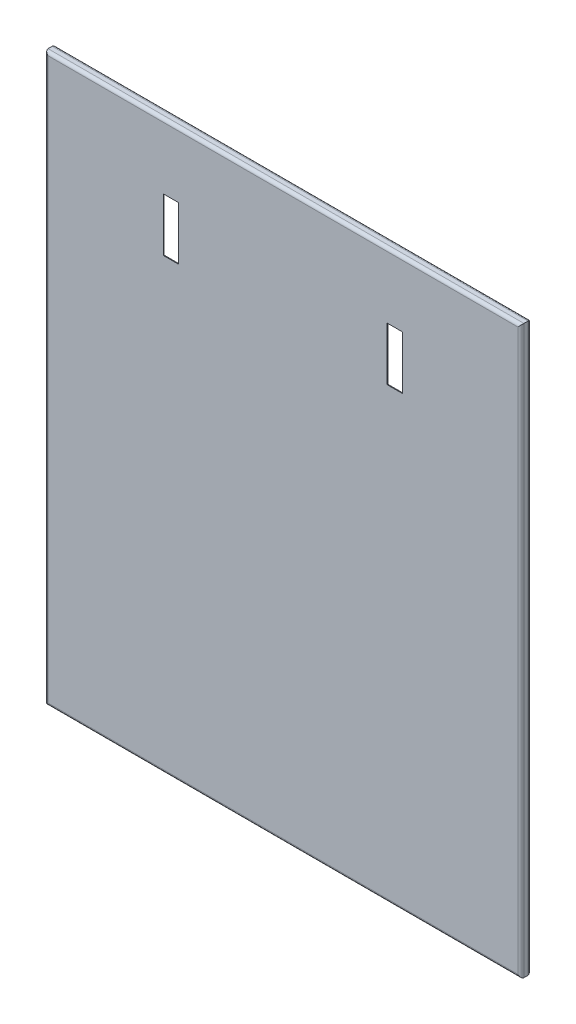
from build123d import *

# Parameters (mm, degrees)
SKETCH_1_W      = 776
SKETCH_1_H      = 924
SKETCH_1_W_2    = 25
SKETCH_1_H_2    = 87
EXTRUDE_1_DEPTH = 1.2
SKETCH_2_W      = 776
SKETCH_2_H      = 924
SKETCH_2_W_2    = 773.6
SKETCH_2_H_2    = 921.6
EXTRUDE_2_DEPTH = 15.5
SKETCH_3_W      = 776
SKETCH_3_H      = 924
SKETCH_3_W_2    = 746
SKETCH_3_H_2    = 894
EXTRUDE_3_DEPTH = 1.2
FILLET_1_R      = 2
FILLET_2_R      = 5
FILLET_3_R      = 5


with BuildPart() as part:
    # 스케치1 → 보스-돌출1 (new body)
    with BuildSketch(Plane.XY):
        with Locations((388, 462)):
            Rectangle(SKETCH_1_W, SKETCH_1_H)
        with Locations((205.5, 774.5)):
            Rectangle(SKETCH_1_W_2, SKETCH_1_H_2, mode=Mode.SUBTRACT)
        with Locations((570.5, 774.5)):
            Rectangle(SKETCH_1_W_2, SKETCH_1_H_2, mode=Mode.SUBTRACT)
    extrude(amount=EXTRUDE_1_DEPTH)

    # 스케치2 → 보스-돌출2 (add)
    with BuildSketch(Plane(origin=(0, 0, 0), x_dir=(-1, 0, 0), z_dir=(0, 0, -1))):
        with Locations((-388, 462)):
            Rectangle(SKETCH_2_W, SKETCH_2_H)
        with Locations((-388, 462)):
            Rectangle(SKETCH_2_W_2, SKETCH_2_H_2, mode=Mode.SUBTRACT)
    extrude(amount=EXTRUDE_2_DEPTH)

    # 스케치3 → 보스-돌출3 (add)
    with BuildSketch(Plane(origin=(0, 0, -15.5), x_dir=(-1, 0, 0), z_dir=(0, 0, -1))):
        with Locations((-388, 462)):
            Rectangle(SKETCH_3_W, SKETCH_3_H)
        with Locations((-388, 462)):
            Rectangle(SKETCH_3_W_2, SKETCH_3_H_2, mode=Mode.SUBTRACT)
    extrude(amount=-EXTRUDE_3_DEPTH)

    # 필렛1
    fillet_1_edges = [part.edges().sort_by_distance(p)[0] for p in [
        (1.2, 462, 0),
        (388, 922.8, 0),
        (774.8, 462, 0),
        (388, 1.2, 0),
        (774.8, 1.2, -7.15),
        (1.2, 1.2, -7.15),
        (388, 1.2, -14.3),
        (774.8, 922.8, -7.15),
        (1.2, 922.8, -7.15),
        (1.2, 462, -14.3),
        (388, 922.8, -14.3),
        (774.8, 462, -14.3),
    ]]
    fillet(fillet_1_edges, radius=FILLET_1_R)

    # 필렛2
    fillet_2_edges = [part.edges().sort_by_distance(p)[0] for p in [
        (776, 462, 1.2),
        (388, 924, 1.2),
        (0, 462, 1.2),
        (388, 0, 1.2),
    ]]
    fillet(fillet_2_edges, radius=FILLET_2_R)

    # 필렛3
    fillet_3_edges = [part.edges().sort_by_distance(p)[0] for p in [
        (388, 0, -15.5),
        (0, 462, -15.5),
        (388, 924, -15.5),
        (776, 462, -15.5),
    ]]
    fillet(fillet_3_edges, radius=FILLET_3_R)


solid = part.part
